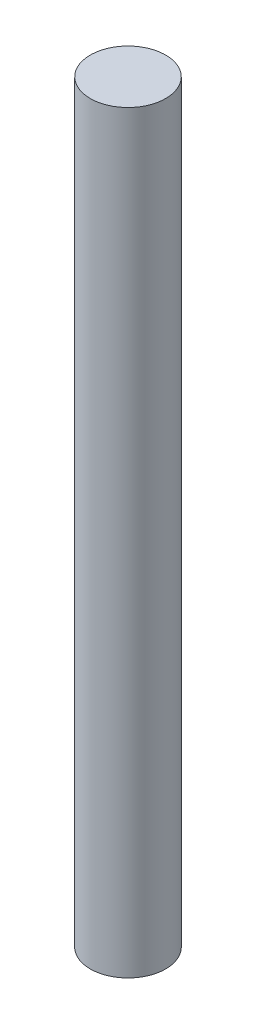
from build123d import *

# Parameters (mm, degrees)
SKETCH2_R           = 0.508
BOSS_EXTRUDE1_DEPTH = 10.16


with BuildPart() as part:
    # Sketch2 → Boss-Extrude1 (new body)
    with BuildSketch(Plane(origin=(0, 0, 0), x_dir=(1, 0, 0), z_dir=(0, 1, 0))):
        with Locations(Location((0, 0, 0), (0, 0, 270))):
            Circle(SKETCH2_R)
    extrude(amount=BOSS_EXTRUDE1_DEPTH)


solid = part.part
